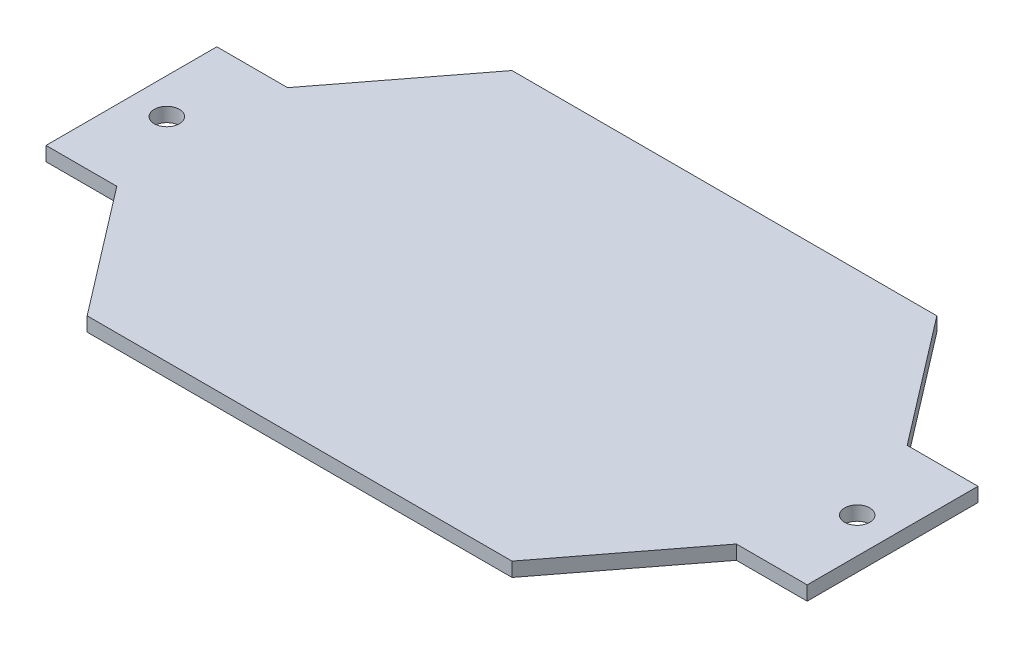
from build123d import *

# Parameters (mm, degrees)
SKETCH1_R           = 2.25
BOSS_EXTRUDE1_DEPTH = 2.54


with BuildPart() as part:
    # Sketch1 → Boss-Extrude1 (new body)
    with BuildSketch(Plane(origin=(0, 0, 0), x_dir=(1, 0, 0), z_dir=(0, 1, 0))):
        Polygon((-6.35, 15.319156813), (6.35, 15.319156813), (23.8125, 38.1), (100.0125, 38.1), (117.475, 15.319156813), (130.175, 15.319156813), (130.175, -15.319156813), (117.475, -15.319156813), (100.0125, -38.1), (23.8125, -38.1), (6.35, -15.319156813), (-6.35, -15.319156813), align=None)
        with Locations(Location((0, 0, 0), (0, 0, 270))):
            Circle(SKETCH1_R, mode=Mode.SUBTRACT)
        with Locations(Location((123.825, 0, 0), (0, 0, 270))):
            Circle(SKETCH1_R, mode=Mode.SUBTRACT)
    extrude(amount=BOSS_EXTRUDE1_DEPTH)


solid = part.part
